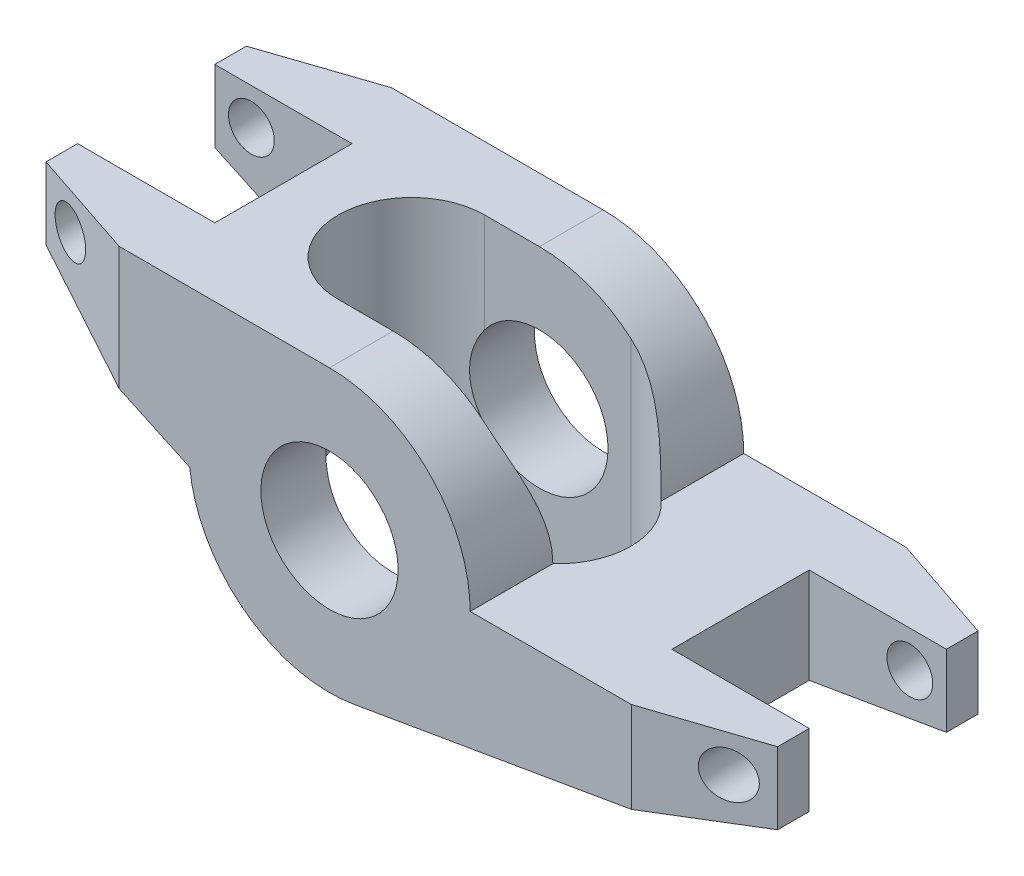
from build123d import *
from OCP.BRepFilletAPI import BRepFilletAPI_MakeChamfer

# Parameters (mm, degrees)
SKETCH1_R               = 4.765
BOSS_EXTRUDE1_DEPTH     = 9.5
CHAMFER4_SIZE           = 7.54
CHAMFER4_SIZE2          = 2.54
CHAMFER5_SIZE           = 2.54
CHAMFER5_SIZE2          = 7.62
CUT_EXTRUDE1_DEPTH      = 32.662585176
CUT_EXTRUDE1_DEPTH_BACK = 32.662585176
SKETCH2_W               = 9.53
SKETCH2_H               = 9.53
CUT_EXTRUDE2_DEPTH      = 32.662585176
CUT_EXTRUDE2_DEPTH_BACK = 32.662585176
CUT_EXTRUDE3_DEPTH      = 32.662585236
CUT_EXTRUDE3_DEPTH_BACK = 32.662585236
SKETCH4_R               = 1.59


with BuildPart() as part:
    # Sketch1 → Boss-Extrude1 (new, symmetric)
    with BuildSketch(Plane.XY):
        with BuildLine():
            Line((0, 9.77), (-22.23, 9.77))
            Line((-22.23, 9.77), (-22.23, 4.77))
            Line((-22.23, 4.77), (-9.711509246, -1.067468107))
            ThreePointArc((-9.711509246, -1.067468107), (-5.877874817, -7.804068659), (1.655323868, -9.628748771))
            Line((1.655323868, -9.628748771), (28.58, -5))
            Line((28.58, -5), (28.58, 0))
            Line((28.58, 0), (9.77, 0))
            ThreePointArc((9.77, 0), (6.908433252, 6.908433252), (0, 9.77))
        make_face()
        Circle(SKETCH1_R, mode=Mode.SUBTRACT)
    extrude(amount=BOSS_EXTRUDE1_DEPTH, both=True)

    # Chamfer4
    chamfer4_edges = [part.edges().sort_by_distance(p)[0] for p in [
        (-22.23, 7.27, -9.5),
        (28.58, -2.5, -9.5),
    ]]
    chamfer4_side = [part.faces().sort_by_distance(p)[0] for p in [
        (-11.115, 9.225622585, -9.5),
    ]]
    chamfer(chamfer4_edges, length=CHAMFER4_SIZE, length2=CHAMFER4_SIZE2, reference=chamfer4_side[0])

    # Chamfer5: one chamfer whose edges measure the first distance from different faces: ONE call of the kernel's chamfer builder (chamfer() names one face for all edges)
    chamfer5_edges_1 = [part.edges().sort_by_distance(p)[0] for p in [
        (-22.23, 7.27, 9.5),
    ]]
    chamfer5_side_1 = [part.faces().sort_by_distance(p)[0] for p in [
        (-22.23, 7.27, 1.27),
    ]]
    chamfer5_edges_2 = [part.edges().sort_by_distance(p)[0] for p in [
        (28.58, -2.5, 9.5),
    ]]
    chamfer5_side_2 = [part.faces().sort_by_distance(p)[0] for p in [
        (28.58, -2.5, 1.27),
    ]]
    chamfer5 = BRepFilletAPI_MakeChamfer(part.part.solid().wrapped)
    for e in chamfer5_edges_1:
        chamfer5.Add(CHAMFER5_SIZE, CHAMFER5_SIZE2, e.wrapped, chamfer5_side_1[0].wrapped)  # the first distance lies on this face
    for e in chamfer5_edges_2:
        chamfer5.Add(CHAMFER5_SIZE, CHAMFER5_SIZE2, e.wrapped, chamfer5_side_2[0].wrapped)  # the first distance lies on this face
    add(Compound.cast(chamfer5.Shape()), mode=Mode.REPLACE)

    # Sketch2 → Cut-Extrude1 (cut, two sides: drawn at the far end of the back side and taken through both)
    with BuildSketch(Plane(origin=(0, 0, 0), x_dir=(1, 0, 0), z_dir=(0, 1, 0)).offset(-CUT_EXTRUDE1_DEPTH_BACK)):
        with Locations((-17.465, 0)):
            Rectangle(SKETCH2_W, SKETCH2_H)
        with Locations((23.815, 0)):
            Rectangle(SKETCH2_W, SKETCH2_H)
    extrude(amount=CUT_EXTRUDE1_DEPTH + CUT_EXTRUDE1_DEPTH_BACK, mode=Mode.SUBTRACT)

    # Sketch3 → Cut-Extrude2 (cut, two sides: drawn at the far end of the back side and taken through both)
    with BuildSketch(Plane(origin=(0, 0, 0), x_dir=(1, 0, 0), z_dir=(0, 1, 0)).offset(-CUT_EXTRUDE2_DEPTH_BACK)):
        with BuildLine():
            Line((-3.81, 5.08), (6.35, 5.08))
            ThreePointArc((6.35, 5.08), (11.43, 0), (6.35, -5.08))
            Line((6.35, -5.08), (-3.81, -5.08))
            ThreePointArc((-3.81, -5.08), (-8.89, 0), (-3.81, 5.08))
        make_face()
    extrude(amount=CUT_EXTRUDE2_DEPTH + CUT_EXTRUDE2_DEPTH_BACK, mode=Mode.SUBTRACT)

    # Sketch4 → Cut-Extrude3 (cut, two sides: drawn at the far end of the back side and taken through both)
    with BuildSketch(Plane.XY.offset(-CUT_EXTRUDE3_DEPTH_BACK)):
        with Locations(Location((-19.69, 7.23, 0), (0, 0, 180))):
            Circle(SKETCH4_R)
        with Locations(Location((26.04, -2.54, 0), (0, 0, 180))):
            Circle(SKETCH4_R)
    extrude(amount=CUT_EXTRUDE3_DEPTH + CUT_EXTRUDE3_DEPTH_BACK, mode=Mode.SUBTRACT)


solid = part.part
